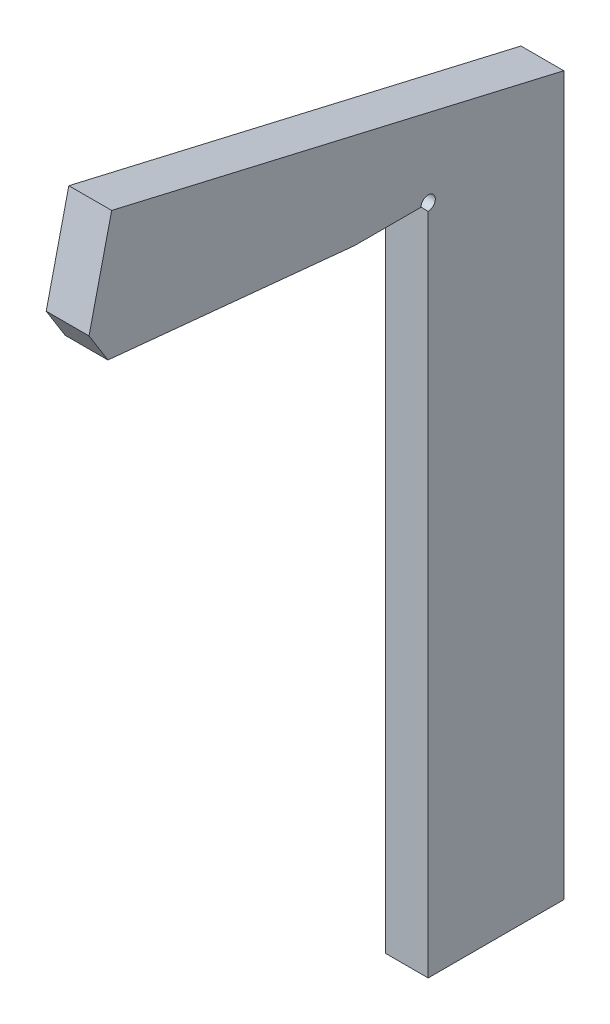
from build123d import *

# Parameters (mm, degrees)
BOSS_EXTRUDE1_DEPTH = 19.05
BOSS_EXTRUDE2_DEPTH = 19.05
CHAMFER1_SIZE       = 12.7
CHAMFER1_SIZE2      = 11.325028866


with BuildPart() as part:
    # Sketch2 → Boss-Extrude1 (new body)
    with BuildSketch(Plane(origin=(-113.788766336, 0, 0), x_dir=(0, 0, -1), z_dir=(1, 0, 0))):
        with BuildLine():
            Line((0, 20.824633003), (-83.828599938, 40.306941911))
            Line((-83.828599938, 40.306941911), (-93.196193981, 0))
            Line((-93.196193981, 0), (-63.5, 0))
            ThreePointArc((-63.5, 0), (-58.07993597, 2.24506403), (-60.325, -3.175))
            Line((-60.325, -3.175), (-60.325, -298.45))
            Line((-60.325, -298.45), (0, -298.45))
            Line((0, -298.45), (0, 20.824633003))
        make_face()
    extrude(amount=BOSS_EXTRUDE1_DEPTH)

    # Sketch3 → Boss-Extrude2 (add, through all)
    with BuildSketch(Plane.ZY.offset(113.788766336)):
        Polygon((83.828599938, 40.306941911), (201.08567571, 67.558244849), (214.022912031, 11.891823944), (93.196193981, 0), align=None)
    extrude(amount=-BOSS_EXTRUDE2_DEPTH)

    # Chamfer1
    chamfer1_edges = [part.edges().sort_by_distance(p)[0] for p in [
        (-104.263766336, 11.891823944, 214.022912031),
    ]]
    chamfer1_side = [part.faces().sort_by_distance(p)[0] for p in [
        (-104.263766336, 39.725034397, 207.554293871),
    ]]
    chamfer(chamfer1_edges, length=CHAMFER1_SIZE, length2=CHAMFER1_SIZE2, reference=chamfer1_side[0])


solid = part.part
